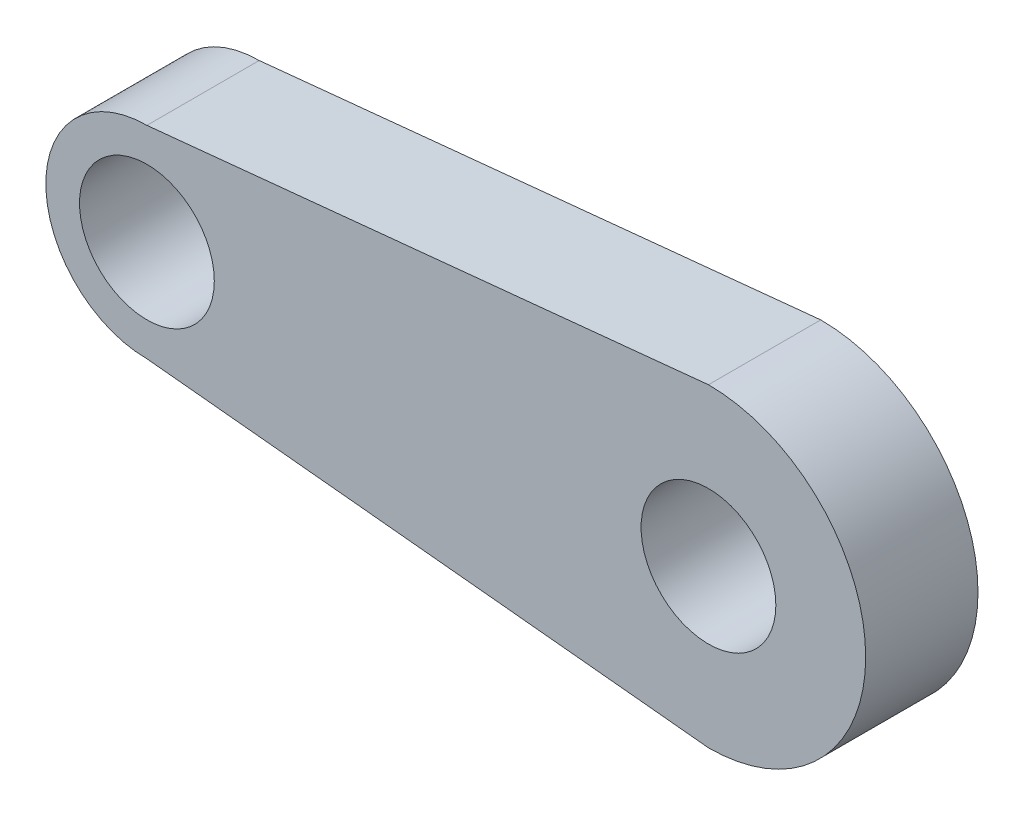
from build123d import *

# Parameters (mm, degrees)
SKETCH1_R           = 3
SKETCH1_R_2         = 4.5
BOSS_EXTRUDE1_DEPTH = 5


with BuildPart() as part:
    # Sketch1 → Boss-Extrude1 (new body)
    # profile 1 of 3: a face of its own
    with BuildSketch(Plane.XY):
        with BuildLine():
            Line((-1.386138614, 6.861386139), (-25, 4.5))
            ThreePointArc((-25, 4.5), (-21.818019485, 3.181980515), (-20.5, 0))
            ThreePointArc((-20.5, 0), (-21.818019485, -3.181980515), (-25, -4.5))
            Line((-25, -4.5), (-1.386138614, -6.861386139))
            ThreePointArc((-1.386138614, -6.861386139), (-7, 0), (-1.386138614, 6.861386139))
        make_face()
    # profile 2 of 3: a face of its own
    with BuildSketch(Plane.XY):
        with BuildLine():
            Line((0, 7), (-1.386138614, 6.861386139))
            ThreePointArc((-1.386138614, 6.861386139), (-7, 0), (-1.386138614, -6.861386139))
            Line((-1.386138614, -6.861386139), (0, -7))
            ThreePointArc((0, -7), (4.949747468, -4.949747468), (7, 0))
            ThreePointArc((7, 0), (4.949747468, 4.949747468), (0, 7))
        make_face()
        Circle(SKETCH1_R, mode=Mode.SUBTRACT)
    # profile 3 of 3: a face of its own
    with BuildSketch(Plane.XY):
        with Locations((-25, 0)):
            Circle(SKETCH1_R_2)
        with Locations((-25, 0)):
            Circle(SKETCH1_R, mode=Mode.SUBTRACT)
    extrude(amount=BOSS_EXTRUDE1_DEPTH)


solid = part.part
